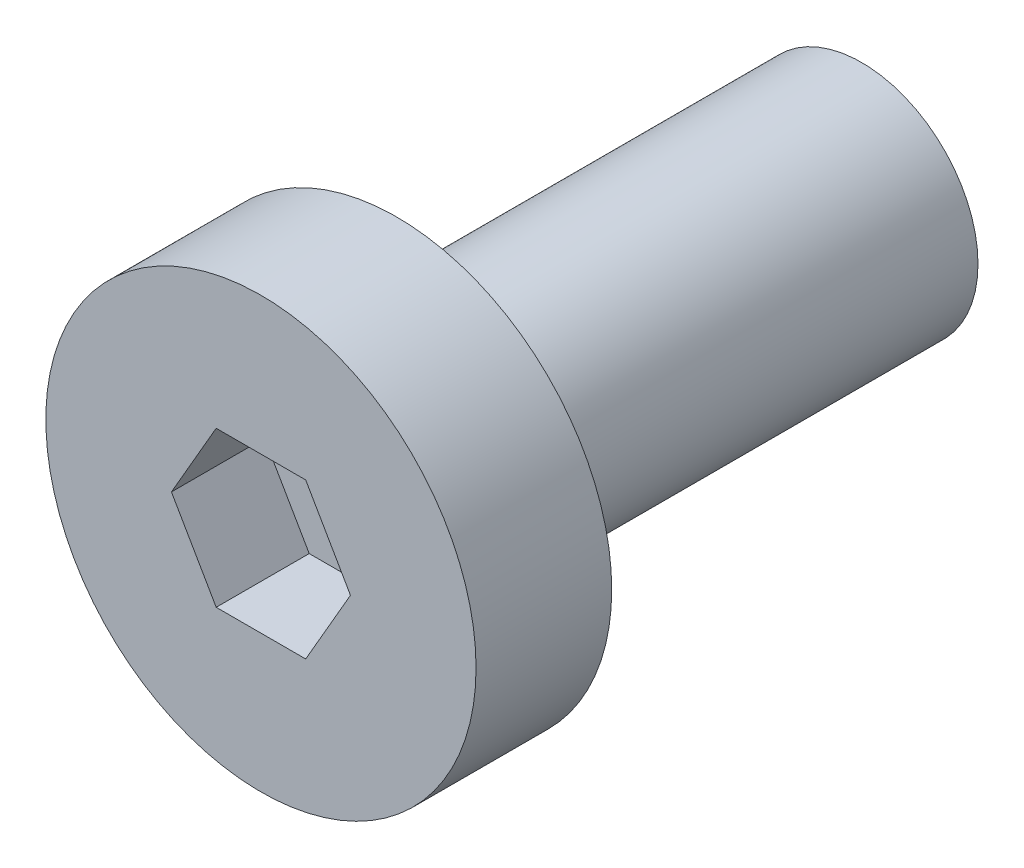
from build123d import *

# Parameters (mm, degrees)
SKETCH1_R           = 2.775
BOSS_EXTRUDE1_DEPTH = 1.75
SKETCH2_R           = 1.5
BOSS_EXTRUDE2_DEPTH = 6
CUT_EXTRUDE1_DEPTH  = 1.2


with BuildPart() as part:
    # Sketch1 → Boss-Extrude1 (new body)
    with BuildSketch(Plane.XY):
        Circle(SKETCH1_R)
    extrude(amount=BOSS_EXTRUDE1_DEPTH)

    # Sketch2 → Boss-Extrude2 (add)
    with BuildSketch(Plane(origin=(0, 0, 0), x_dir=(-1, 0, 0), z_dir=(0, 0, -1))):
        Circle(SKETCH2_R)
    extrude(amount=BOSS_EXTRUDE2_DEPTH)

    # Sketch3 → Cut-Extrude1 (cut)
    with BuildSketch(Plane.XY.offset(1.75)):
        Polygon((1.154700538, 0), (0.577350269, 1), (-0.577350269, 1), (-1.154700538, 0), (-0.577350269, -1), (0.577350269, -1), align=None)
    extrude(amount=-CUT_EXTRUDE1_DEPTH, mode=Mode.SUBTRACT)


solid = part.part
